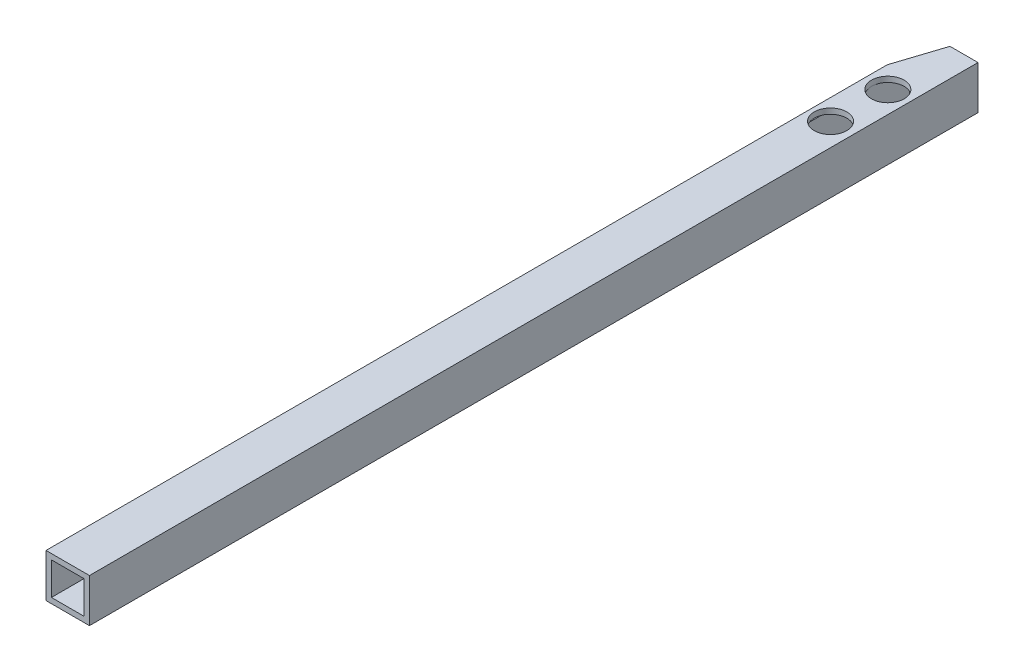
from build123d import *

# Parameters (mm, degrees)
BOSS_EXTRUDE1_DEPTH      = 266.7
BOSS_EXTRUDE1_DEPTH_BACK = 266.7
SKETCH3_W                = 25.4
SKETCH3_H                = 25.4
SKETCH3_W_2              = 19.05
SKETCH3_H_2              = 19.05
SKETCH4_R                = 9.525
CUT_EXTRUDE1_DEPTH       = 25.4
SKETCH5_R                = 9.525
CUT_EXTRUDE2_DEPTH       = 3.175


with BuildPart() as part:
    # Sketch3 → Boss-Extrude1 (new, two sides: drawn at the far end of the back side and taken through both)
    with BuildSketch(Plane.XY.offset(-BOSS_EXTRUDE1_DEPTH_BACK)):
        Rectangle(SKETCH3_W, SKETCH3_H)
        Rectangle(SKETCH3_W_2, SKETCH3_H_2, mode=Mode.SUBTRACT)
    extrude(amount=BOSS_EXTRUDE1_DEPTH + BOSS_EXTRUDE1_DEPTH_BACK)

    # Sketch4 → Cut-Extrude1 (cut)
    with BuildSketch(Plane(origin=(0, 12.7, 0), x_dir=(1, 0, 0), z_dir=(0, 1, 0))):
        with Locations(Location((0, 212.725, 0), (0, 0, 180))):
            Circle(SKETCH4_R)
        Polygon((-12.7, 225.013453558), (-12.7, 266.7), (12.7, 266.7), (12.7, 252.73), (-3.69434815, 252.73), align=None)
    extrude(amount=-CUT_EXTRUDE1_DEPTH, mode=Mode.SUBTRACT)

    # Sketch5 → Cut-Extrude2 (cut)
    with BuildSketch(Plane.XZ.offset(-12.7)):
        with Locations(Location((-0.660548484, -179.870948658, 0), (0, 0, 201.463465423))):
            Circle(SKETCH5_R)
    extrude(amount=CUT_EXTRUDE2_DEPTH, mode=Mode.SUBTRACT)


solid = part.part
